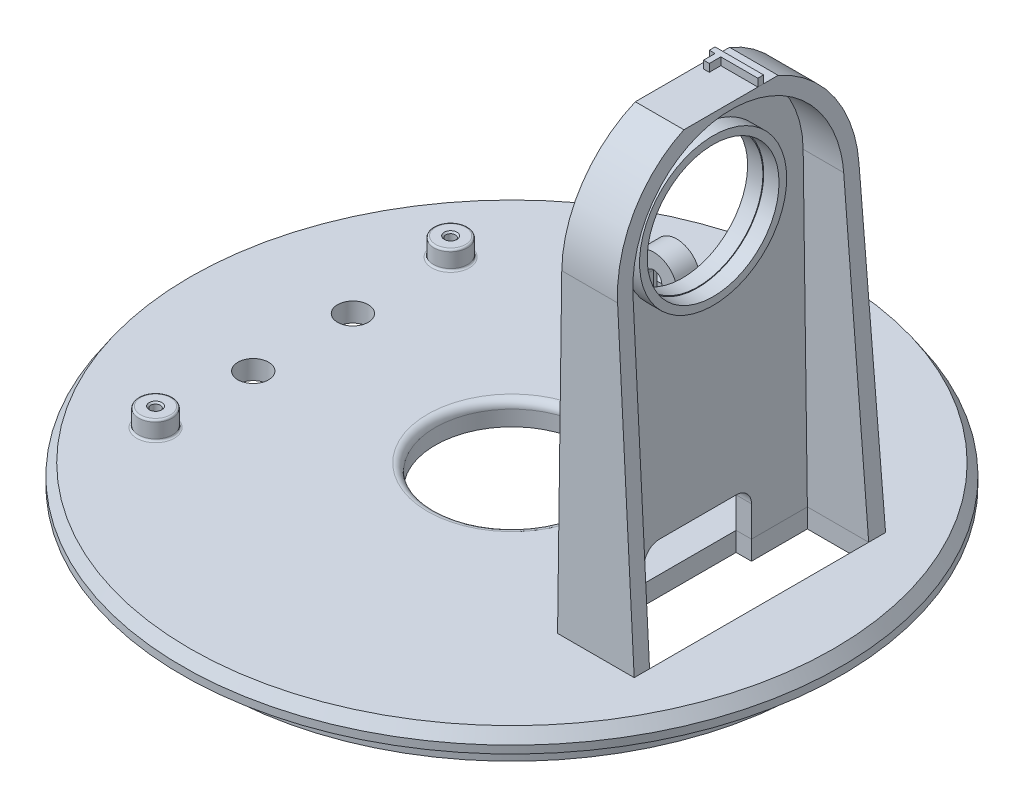
from build123d import *

# Parameters (mm, degrees)
ESQUISSE2_R                  = 3
BOSS_EXTRU_1_DEPTH           = 3
R_P_TITION_CIRCULAIRE1_COUNT = 3
ESQUISSE3_R                  = 2
ENL_V_MAT_EXTRU_1_DEPTH      = 62.15758334
ESQUISSE4_R                  = 8.5
BOSS_EXTRU_2_DEPTH           = 10
ENL_V_MAT_EXTRU_3_DEPTH      = 8
ENL_V_MAT_EXTRU_2_DEPTH      = 97.450021044
ESQUISSE8_W                  = 8
ESQUISSE8_H                  = 28.592117776
ENL_V_MAT_EXTRU_4_DEPTH      = 83.837566961
CONG_1_R                     = 0.5
ENL_V_MAT_EXTRU_5_DEPTH      = 5
ENL_V_MAT_EXTRU_6_DEPTH      = 2
ESQUISSE11_R                 = 2.2
BOSS_EXTRU_3_DEPTH           = 2.4
CONG_3_R                     = 1
BOSS_EXTRU_4_DEPTH           = 3
ENL_V_MAT_EXTRU_7_DEPTH      = 2
ESQUISSE14_W                 = 5.1
ESQUISSE14_H                 = 2
ENL_V_MAT_EXTRU_8_DEPTH      = 10
TROU_TARAUD_M1_61_AT_2_COUNT = 2
TROU_TARAUD_M1_61_AT_2_PITCH = 38.5
CONG_4_R                     = 0.25
ESQUISSE16_R                 = 9.6
ESQUISSE16_R_2               = 8.6
BOSS_EXTRU_5_DEPTH           = 2
ESQUISSE17_W                 = 10
ESQUISSE17_H                 = 32.044814958
ENL_V_MAT_EXTRU_9_DEPTH      = 10
BOSS_EXTRU_6_DEPTH           = 1


with BuildPart() as part:
    # Esquisse1 → Révolution1 (revolve)
    with BuildSketch(Plane(origin=(0, 0, 0), x_dir=(0, 0, -1), z_dir=(1, 0, 0))):
        Polygon((38.5, 0), (38.5, 4), (43, 4), (43, 5), (42, 6.5), (10, 6.5), (10, 3.5), (11, 3.5), (11, 4), (36.9, 4), (36.9, 0), align=None)
    revolve(axis=Axis((0, -26.722952837, 0), (0, 1, 0)))

    # Esquisse2 → Boss.-Extru.1 (add)
    with BuildSketch(Plane.XZ.offset(-4)):
        with Locations(Location((-16, 0, 0), (0, 0, 270))):
            Circle(ESQUISSE2_R)
    boss_extru_1 = extrude(amount=BOSS_EXTRU_1_DEPTH)

    # Répétition circulaire1: Boss.-Extru.1 ×3 about axis
    r_p_tition_circulaire1_axis = Axis((0, 0, 0), (0, 1, 0))
    for i in range(1, R_P_TITION_CIRCULAIRE1_COUNT):
        add(boss_extru_1.rotate(r_p_tition_circulaire1_axis, i * 360 / R_P_TITION_CIRCULAIRE1_COUNT))

    # Esquisse3 → Enlèv. mat.-Extru.1 (cut, through all)
    with BuildSketch(Plane(origin=(0, 6.5, 0), x_dir=(1, 0, 0), z_dir=(0, 1, 0))):
        with Locations(Location((-27.25, 6.5, 0), (0, 0, 270))):
            Circle(ESQUISSE3_R)
        with Locations(Location((-27.25, -6.5, 0), (0, 0, 270))):
            Circle(ESQUISSE3_R)
    extrude(amount=-ENL_V_MAT_EXTRU_1_DEPTH, mode=Mode.SUBTRACT)

    # Esquisse8 → Enlèv. mat.-Extru.4 (cut, through all)
    with BuildSketch(Plane(origin=(0, 6.5, 0), x_dir=(-1, 0, 0), z_dir=(0, 1, 0))):
        with Locations((-28.25, 0)):
            Rectangle(ESQUISSE8_W, ESQUISSE8_H)
    extrude(amount=-ENL_V_MAT_EXTRU_4_DEPTH, mode=Mode.SUBTRACT)

    # Congé1
    cong_1_edges = [part.edges().sort_by_distance(p)[0] for p in [
        (-16, 4, 3),
        (5.401923789, 4, -15.356406461),
        (10.598076211, 4, 12.356406461),
    ]]
    fillet(cong_1_edges, radius=CONG_1_R)

    # Esquisse9 → Enlèv. mat.-Extru.5 (cut)
    with BuildSketch(Plane.XZ.offset(-1)):
        with BuildLine():
            ThreePointArc((8.249130432, -12.377239794), (8, -12.106406461), (7.750869568, -12.377239794))
            ThreePointArc((7.750869568, -12.377239794), (7.611771432, -12.407517721), (7.47616995, -12.450845335))
            ThreePointArc((7.47616995, -12.450845335), (7.125, -12.340862004), (7.044663384, -12.699975767))
            ThreePointArc((7.044663384, -12.699975767), (6.939339828, -12.795746289), (6.843569306, -12.901069844))
            ThreePointArc((6.843569306, -12.901069844), (6.484455543, -12.981406461), (6.594438874, -13.33257641))
            ThreePointArc((6.594438874, -13.33257641), (6.551111261, -13.468177893), (6.520833333, -13.607276028))
            ThreePointArc((6.520833333, -13.607276028), (6.25, -13.856406461), (6.520833333, -14.105536893))
            ThreePointArc((6.520833333, -14.105536893), (6.551111261, -14.244635028), (6.594438874, -14.380236511))
            ThreePointArc((6.594438874, -14.380236511), (6.484455543, -14.731406461), (6.843569306, -14.811743077))
            ThreePointArc((6.843569306, -14.811743077), (6.939339828, -14.917066632), (7.044663384, -15.012837154))
            ThreePointArc((7.044663384, -15.012837154), (7.125, -15.371950917), (7.47616995, -15.261967586))
            ThreePointArc((7.47616995, -15.261967586), (7.611771432, -15.3052952), (7.750869568, -15.335573127))
            ThreePointArc((7.750869568, -15.335573127), (8, -15.606406461), (8.249130432, -15.335573127))
            ThreePointArc((8.249130432, -15.335573127), (8.388228568, -15.3052952), (8.52383005, -15.261967586))
            ThreePointArc((8.52383005, -15.261967586), (8.875, -15.371950917), (8.955336616, -15.012837154))
            ThreePointArc((8.955336616, -15.012837154), (9.060660172, -14.917066632), (9.156430694, -14.811743077))
            ThreePointArc((9.156430694, -14.811743077), (9.515544457, -14.731406461), (9.405561126, -14.380236511))
            ThreePointArc((9.405561126, -14.380236511), (9.448888739, -14.244635028), (9.479166667, -14.105536893))
            ThreePointArc((9.479166667, -14.105536893), (9.75, -13.856406461), (9.479166667, -13.607276028))
            ThreePointArc((9.479166667, -13.607276028), (9.448888739, -13.468177893), (9.405561126, -13.33257641))
            ThreePointArc((9.405561126, -13.33257641), (9.515544457, -12.981406461), (9.156430694, -12.901069844))
            ThreePointArc((9.156430694, -12.901069844), (9.060660172, -12.795746289), (8.955336616, -12.699975767))
            ThreePointArc((8.955336616, -12.699975767), (8.875, -12.340862004), (8.52383005, -12.450845335))
            ThreePointArc((8.52383005, -12.450845335), (8.388228568, -12.407517721), (8.249130432, -12.377239794))
        make_face()
        with BuildLine():
            ThreePointArc((-16.142194986, 1.493244985), (-16.452933329, 1.690370196), (-16.623478023, 1.364285584))
            ThreePointArc((-16.623478023, 1.364285584), (-16.75, 1.299038106), (-16.869766963, 1.222090598))
            ThreePointArc((-16.869766963, 1.222090598), (-17.237436867, 1.237436867), (-17.222090598, 0.869766963))
            ThreePointArc((-17.222090598, 0.869766963), (-17.299038106, 0.75), (-17.364285584, 0.623478023))
            ThreePointArc((-17.364285584, 0.623478023), (-17.690370196, 0.452933329), (-17.493244985, 0.142194986))
            ThreePointArc((-17.493244985, 0.142194986), (-17.5, 0), (-17.493244985, -0.142194986))
            ThreePointArc((-17.493244985, -0.142194986), (-17.690370196, -0.452933329), (-17.364285584, -0.623478023))
            ThreePointArc((-17.364285584, -0.623478023), (-17.299038106, -0.75), (-17.222090598, -0.869766963))
            ThreePointArc((-17.222090598, -0.869766963), (-17.237436867, -1.237436867), (-16.869766963, -1.222090598))
            ThreePointArc((-16.869766963, -1.222090598), (-16.75, -1.299038106), (-16.623478023, -1.364285584))
            ThreePointArc((-16.623478023, -1.364285584), (-16.452933329, -1.690370196), (-16.142194986, -1.493244985))
            ThreePointArc((-16.142194986, -1.493244985), (-16, -1.5), (-15.857805014, -1.493244985))
            ThreePointArc((-15.857805014, -1.493244985), (-15.547066671, -1.690370196), (-15.376521977, -1.364285584))
            ThreePointArc((-15.376521977, -1.364285584), (-15.25, -1.299038106), (-15.130233037, -1.222090598))
            ThreePointArc((-15.130233037, -1.222090598), (-14.762563133, -1.237436867), (-14.777909402, -0.869766963))
            ThreePointArc((-14.777909402, -0.869766963), (-14.700961894, -0.75), (-14.635714416, -0.623478023))
            ThreePointArc((-14.635714416, -0.623478023), (-14.309629804, -0.452933329), (-14.506755015, -0.142194986))
            ThreePointArc((-14.506755015, -0.142194986), (-14.5, 0), (-14.506755015, 0.142194986))
            ThreePointArc((-14.506755015, 0.142194986), (-14.309629804, 0.452933329), (-14.635714416, 0.623478023))
            ThreePointArc((-14.635714416, 0.623478023), (-14.700961894, 0.75), (-14.777909402, 0.869766963))
            ThreePointArc((-14.777909402, 0.869766963), (-14.762563133, 1.237436867), (-15.130233037, 1.222090598))
            ThreePointArc((-15.130233037, 1.222090598), (-15.25, 1.299038106), (-15.376521977, 1.364285584))
            ThreePointArc((-15.376521977, 1.364285584), (-15.547066671, 1.690370196), (-15.857805014, 1.493244985))
            ThreePointArc((-15.857805014, 1.493244985), (-16, 1.5), (-16.142194986, 1.493244985))
        make_face()
        with BuildLine():
            ThreePointArc((8.249130432, 15.335573127), (8, 15.606406461), (7.750869568, 15.335573127))
            ThreePointArc((7.750869568, 15.335573127), (7.611771432, 15.3052952), (7.47616995, 15.261967586))
            ThreePointArc((7.47616995, 15.261967586), (7.125, 15.371950917), (7.044663384, 15.012837154))
            ThreePointArc((7.044663384, 15.012837154), (6.939339828, 14.917066632), (6.843569306, 14.811743077))
            ThreePointArc((6.843569306, 14.811743077), (6.484455543, 14.731406461), (6.594438874, 14.380236511))
            ThreePointArc((6.594438874, 14.380236511), (6.551111261, 14.244635028), (6.520833333, 14.105536893))
            ThreePointArc((6.520833333, 14.105536893), (6.25, 13.856406461), (6.520833333, 13.607276028))
            ThreePointArc((6.520833333, 13.607276028), (6.551111261, 13.468177893), (6.594438874, 13.33257641))
            ThreePointArc((6.594438874, 13.33257641), (6.484455543, 12.981406461), (6.843569306, 12.901069844))
            ThreePointArc((6.843569306, 12.901069844), (6.939339828, 12.795746289), (7.044663384, 12.699975767))
            ThreePointArc((7.044663384, 12.699975767), (7.125, 12.340862004), (7.47616995, 12.450845335))
            ThreePointArc((7.47616995, 12.450845335), (7.611771432, 12.407517721), (7.750869568, 12.377239794))
            ThreePointArc((7.750869568, 12.377239794), (8, 12.106406461), (8.249130432, 12.377239794))
            ThreePointArc((8.249130432, 12.377239794), (8.388228568, 12.407517721), (8.52383005, 12.450845335))
            ThreePointArc((8.52383005, 12.450845335), (8.875, 12.340862004), (8.955336616, 12.699975767))
            ThreePointArc((8.955336616, 12.699975767), (9.060660172, 12.795746289), (9.156430694, 12.901069844))
            ThreePointArc((9.156430694, 12.901069844), (9.515544457, 12.981406461), (9.405561126, 13.33257641))
            ThreePointArc((9.405561126, 13.33257641), (9.448888739, 13.468177893), (9.479166667, 13.607276028))
            ThreePointArc((9.479166667, 13.607276028), (9.75, 13.856406461), (9.479166667, 14.105536893))
            ThreePointArc((9.479166667, 14.105536893), (9.448888739, 14.244635028), (9.405561126, 14.380236511))
            ThreePointArc((9.405561126, 14.380236511), (9.515544457, 14.731406461), (9.156430694, 14.811743077))
            ThreePointArc((9.156430694, 14.811743077), (9.060660172, 14.917066632), (8.955336616, 15.012837154))
            ThreePointArc((8.955336616, 15.012837154), (8.875, 15.371950917), (8.52383005, 15.261967586))
            ThreePointArc((8.52383005, 15.261967586), (8.388228568, 15.3052952), (8.249130432, 15.335573127))
        make_face()
    extrude(amount=-ENL_V_MAT_EXTRU_5_DEPTH, mode=Mode.SUBTRACT)


with BuildPart() as body_2:
    # Esquisse4 → Boss.-Extru.2 (new body)
    with BuildSketch(Plane(origin=(22.25, 0, 0), x_dir=(0, 0, -1), z_dir=(1, 0, 0))):
        with BuildLine():
            Line((-16.296239842, 6.5), (-15.748575116, 47.211853266))
            ThreePointArc((-15.748575116, 47.211853266), (-11.06177678, 58.211583049), (0, 62.75))
            ThreePointArc((0, 62.75), (11.06177678, 58.211583049), (15.748575116, 47.211853266))
            Line((15.748575116, 47.211853266), (16.5, 6.5))
            Line((16.5, 6.5), (-16.296239842, 6.5))
        make_face()
        with Locations((0, 47)):
            Circle(ESQUISSE4_R, mode=Mode.SUBTRACT)
    extrude(amount=BOSS_EXTRU_2_DEPTH)

    # Esquisse7 → Enlèv. mat.-Extru.3 (cut)
    with BuildSketch(Plane(origin=(32.25, 0, 0), x_dir=(0, 0, -1), z_dir=(1, 0, 0))):
        with BuildLine():
            Line((-14.5, -8.660407906), (-13.748756054, 47.184951264))
            ThreePointArc((-13.748756054, 47.184951264), (0, 60.75), (13.748756054, 47.184951264))
            Line((13.748756054, 47.184951264), (14.5, -8.660407906))
            Line((14.5, -8.660407906), (-14.5, -8.660407906))
        make_face()
    extrude(amount=-ENL_V_MAT_EXTRU_3_DEPTH, mode=Mode.SUBTRACT)

    # Esquisse6 → Enlèv. mat.-Extru.2 (cut, through all)
    with BuildSketch(Plane.XY.offset(16.296239842)):
        Polygon((32.25, 6.5), (28.5, 62.75), (32.25, 62.75), align=None)
    extrude(amount=-ENL_V_MAT_EXTRU_2_DEPTH, mode=Mode.SUBTRACT)


with BuildPart() as enl_v_mat_extru_6_tool:
    # Esquisse10 → Enlèv. mat.-Extru.6 (new body)
    with BuildSketch(Plane(origin=(24.25, 0, 0), x_dir=(0, 0, -1), z_dir=(1, 0, 0))):
        with BuildLine():
            Line((-7, 4), (7, 4))
            Line((7, 4), (7, 10.5))
            ThreePointArc((7, 10.5), (6.414213562, 11.914213562), (5, 12.5))
            Line((5, 12.5), (-5, 12.5))
            ThreePointArc((-5, 12.5), (-6.414213562, 11.914213562), (-7, 10.5))
            Line((-7, 10.5), (-7, 4))
        make_face()
    extrude(amount=-ENL_V_MAT_EXTRU_6_DEPTH)


with BuildPart() as part_1:
    add(part.part)

    # Enlèv. mat.-Extru.6: cut by enl_v_mat_extru_6_tool
    add(enl_v_mat_extru_6_tool.part, mode=Mode.SUBTRACT)

    # Esquisse11 → Boss.-Extru.3 (add)
    with BuildSketch(Plane(origin=(0, 6.5, 0), x_dir=(-1, 0, 0), z_dir=(0, 1, 0))):
        with Locations(Location((27.25, -19.25, 0), (0, 0, 90))):
            Circle(ESQUISSE11_R)
        with Locations(Location((27.25, 19.25, 0), (0, 0, 90))):
            Circle(ESQUISSE11_R)
    extrude(amount=BOSS_EXTRU_3_DEPTH)

    # Congé3
    cong_3_edges = [part_1.edges().sort_by_distance(p)[0] for p in [
        (0, 6.5, 10),
    ]]
    fillet(cong_3_edges, radius=CONG_3_R)

    # Esquisse12 → Boss.-Extru.4 (add)
    with BuildSketch(Plane.XY.offset(-27)):
        with BuildLine():
            Line((5.45, 6.5), (5.45, 9.5))
            ThreePointArc((5.45, 9.5), (8.5, 12.55), (11.55, 9.5))
            Line((11.55, 9.5), (11.55, 6.5))
            Line((11.55, 6.5), (9.55, 6.5))
            Line((9.55, 6.5), (9.55, 9.5))
            ThreePointArc((9.55, 9.5), (8.5, 10.55), (7.45, 9.5))
            Line((7.45, 9.5), (7.45, 6.5))
            Line((7.45, 6.5), (5.45, 6.5))
        make_face()
    boss_extru_4 = extrude(amount=-BOSS_EXTRU_4_DEPTH)

    # Esquisse13 → Enlèv. mat.-Extru.7 (cut)
    with BuildSketch(Plane(origin=(0, 0, -30), x_dir=(-1, 0, 0), z_dir=(0, 0, -1))):
        with BuildLine():
            Line((-5.95, 6.5), (-5.95, 9.5))
            ThreePointArc((-5.95, 9.5), (-8.5, 12.05), (-11.05, 9.5))
            Line((-11.05, 9.5), (-11.05, 6.5))
            Line((-11.05, 6.5), (-5.95, 6.5))
        make_face()
    enl_v_mat_extru_7 = extrude(amount=-ENL_V_MAT_EXTRU_7_DEPTH, mode=Mode.SUBTRACT)

    # Symétrie1: Boss.-Extru.4, Enlèv. mat.-Extru.7 across plane
    add(boss_extru_4.mirror(Plane(origin=(0, 0, 0), x_dir=(0, 0, 1), z_dir=(1, 0, 0))))
    add(enl_v_mat_extru_7.mirror(Plane(origin=(0, 0, 0), x_dir=(0, 0, 1), z_dir=(1, 0, 0))), mode=Mode.SUBTRACT)

    # Esquisse14 → Enlèv. mat.-Extru.8 (cut)
    with BuildSketch(Plane(origin=(0, 6.5, 0), x_dir=(1, 0, 0), z_dir=(0, 1, 0))):
        with Locations((8.5, 29)):
            Rectangle(ESQUISSE14_W, ESQUISSE14_H)
    enl_v_mat_extru_8 = extrude(amount=-ENL_V_MAT_EXTRU_8_DEPTH, mode=Mode.SUBTRACT)

    # Symétrie2: Enlèv. mat.-Extru.8 across plane
    add(enl_v_mat_extru_8.mirror(Plane(origin=(0, 0, 0), x_dir=(0, 0, 1), z_dir=(1, 0, 0))), mode=Mode.SUBTRACT)

    # Esquisse15 → Trou taraudé M1.61 (revolve, cut)
    with BuildSketch(Plane(origin=(-27.25, 8.9, 19.25), x_dir=(0, 0, 1), z_dir=(1, 0, 0))):
        Polygon((0, 0), (0, 8.9), (0.625, 8.9), (0.625, 0.2), (0.825, 0), align=None)
    trou_taraud_m1_61 = revolve(axis=Axis((-27.25, 15.25, 19.25), (0, -1, 0)), mode=Mode.SUBTRACT)

    # Trou taraudé M1.61 at 2: Trou taraudé M1.61 ×2
    with Locations(*[(0, 0, -i * TROU_TARAUD_M1_61_AT_2_PITCH) for i in range(1, TROU_TARAUD_M1_61_AT_2_COUNT)]):
        add(trou_taraud_m1_61, mode=Mode.SUBTRACT)

    # Congé4
    cong_4_edges = [part_1.edges().sort_by_distance(p)[0] for p in [
        (-27.25, 6.5, -21.45),
        (-27.25, 8.9, -21.45),
        (-27.25, 6.5, 17.05),
        (-27.25, 8.9, 17.05),
    ]]
    fillet(cong_4_edges, radius=CONG_4_R)


with BuildPart() as body_2_1:
    add(body_2.part)

    # Enlèv. mat.-Extru.6: cut by enl_v_mat_extru_6_tool
    add(enl_v_mat_extru_6_tool.part, mode=Mode.SUBTRACT)

    # Esquisse16 → Boss.-Extru.5 (add)
    with BuildSketch(Plane(origin=(24.25, 0, 0), x_dir=(0, 0, -1), z_dir=(1, 0, 0))):
        with Locations((0, 47)):
            Circle(ESQUISSE16_R)
        with Locations((0, 47)):
            Circle(ESQUISSE16_R_2, mode=Mode.SUBTRACT)
    extrude(amount=BOSS_EXTRU_5_DEPTH)

    # Esquisse17 → Enlèv. mat.-Extru.9 (cut)
    with BuildSketch(Plane(origin=(0, 61.5, 0), x_dir=(-1, 0, 0), z_dir=(0, 1, 0))):
        with Locations((-27.25, 0.273832363)):
            Rectangle(ESQUISSE17_W, ESQUISSE17_H)
    extrude(amount=ENL_V_MAT_EXTRU_9_DEPTH, mode=Mode.SUBTRACT)

    # Esquisse18 → Boss.-Extru.6 (add)
    with BuildSketch(Plane(origin=(0, 61.5, 0), x_dir=(-1, 0, 0), z_dir=(0, 1, 0))):
        Polygon((-22.25, -4.25), (-28.583333333, -4.25), (-28.583333333, -3.5), (-23.75, -3.5), (-23.75, -2), (-23, -2), (-23, -3.5), (-22.25, -3.5), align=None)
    extrude(amount=BOSS_EXTRU_6_DEPTH)


solid = Compound([part_1.part, body_2_1.part])
